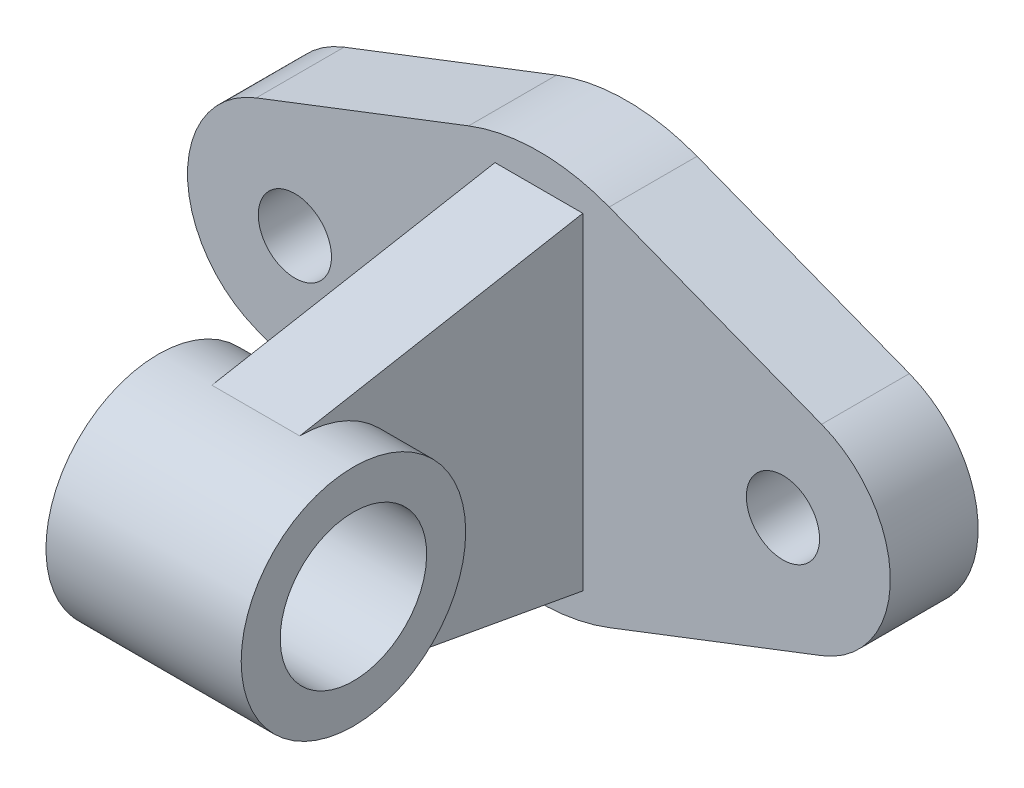
from build123d import *

# Parameters (mm, degrees)
BOSS_EXTRUDE1_DEPTH = 18
SKETCH3_W           = 18
SKETCH3_H           = 67
BOSS_EXTRUDE2_DEPTH = 58
SKETCH4_R           = 23
BOSS_EXTRUDE3_DEPTH = 29
BOSS_EXTRUDE4_START = -40
SKETCH5_R           = 23
BOSS_EXTRUDE4_DEPTH = 40
SKETCH6_R           = 15
CUT_EXTRUDE1_DEPTH  = 141.943250991
CUT_EXTRUDE2_DEPTH  = 135.02238619
SKETCH8_R           = 7.5
CUT_EXTRUDE3_DEPTH  = 116.52056094


with BuildPart() as part:
    # Sketch2 → Boss-Extrude1 (new body)
    with BuildSketch(Plane.XY):
        with BuildLine():
            Line((-57.919997401, 20.524958004), (-14.399995275, 37.31809395))
            ThreePointArc((-14.399995275, 37.31809395), (0, 40), (14.399995275, 37.31809395))
            Line((14.399995275, 37.31809395), (57.919997401, 20.524958004))
            ThreePointArc((57.919997401, 20.524958004), (72, 9.117e-06), (57.920002599, -20.524943336))
            Line((57.920002599, -20.524943336), (14.399995275, -37.31809395))
            ThreePointArc((14.399995275, -37.31809395), (-5.065e-06, -40), (-14.400004725, -37.318090304))
            Line((-14.400004725, -37.318090304), (-57.920002599, -20.524943336))
            ThreePointArc((-57.920002599, -20.524943336), (-72, 9.117e-06), (-57.919997401, 20.524958004))
        make_face()
    extrude(amount=BOSS_EXTRUDE1_DEPTH)

    # Sketch3 → Boss-Extrude2 (add)
    with BuildSketch(Plane.XY.offset(18)):
        Rectangle(SKETCH3_W, SKETCH3_H)
    extrude(amount=BOSS_EXTRUDE2_DEPTH)

    # Sketch4 → Boss-Extrude3 (add)
    with BuildSketch(Plane(origin=(9, 0, 0), x_dir=(0, 0, -1), z_dir=(1, 0, 0))):
        with Locations(Location((-76, 0, 0), (0, 0, 90))):
            Circle(SKETCH4_R)
    extrude(amount=-BOSS_EXTRUDE3_DEPTH)

    # Sketch5 → Boss-Extrude4 (add)
    with BuildSketch(Plane.ZY.offset(20).offset(BOSS_EXTRUDE4_START)):
        with Locations(Location((76, 0, 0), (0, 0, 90))):
            Circle(SKETCH5_R)
    extrude(amount=BOSS_EXTRUDE4_DEPTH)

    # Sketch6 → Cut-Extrude1 (cut, through all)
    with BuildSketch(Plane(origin=(20, 0, 0), x_dir=(0, 0, -1), z_dir=(1, 0, 0))):
        with Locations(Location((-76, 0, 0), (0, 0, 90))):
            Circle(SKETCH6_R)
    extrude(amount=-CUT_EXTRUDE1_DEPTH, mode=Mode.SUBTRACT)

    # Sketch7 → Cut-Extrude2 (cut, through all)
    with BuildSketch(Plane(origin=(9, 0, 0), x_dir=(0, 0, -1), z_dir=(1, 0, 0))):
        Polygon((-18, -33.5), (-76, -23), (-76, -33.5), align=None)
        Polygon((-18, 33.5), (-76, 23), (-76, 33.5), align=None)
    extrude(amount=-CUT_EXTRUDE2_DEPTH, mode=Mode.SUBTRACT)

    # Sketch8 → Cut-Extrude3 (cut, through all)
    with BuildSketch(Plane.XY.offset(18)):
        with Locations((50, 6.331e-06)):
            Circle(SKETCH8_R)
        with Locations((-50, 6.331e-06)):
            Circle(SKETCH8_R)
    extrude(amount=-CUT_EXTRUDE3_DEPTH, mode=Mode.SUBTRACT)


solid = part.part
